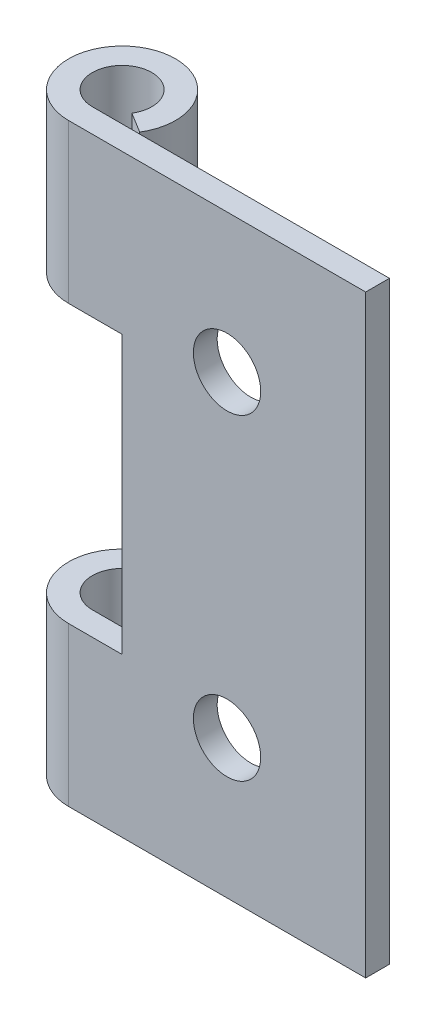
from build123d import *

# Parameters (mm, degrees)
Y_KSEKLIK_EKSTR_ZYON1_DEPTH = 30
KES_EKSTR_ZYON2_START       = -22
KES_EKSTR_ZYON2_DEPTH       = 14
IZIM4_R                     = 1.7
KES_EKSTR_ZYON3_DEPTH       = 1.2


with BuildPart() as part:
    # Çizim1 → Yükseklik-Ekstrüzyon1 (new body)
    with BuildSketch(Plane(origin=(0, 0, 0), x_dir=(1, 0, 0), z_dir=(0, 1, 0))):
        with BuildLine():
            Line((0, 0.6), (15, 0.6))
            Line((15, 0.6), (15, -0.6))
            Line((15, -0.6), (0, -0.6))
            ThreePointArc((0, -0.6), (-1.319038138, 4.455873169), (2.301841896, 0.688786378))
            Line((2.301841896, 0.688786378), (1.278801053, 1.315992432))
            ThreePointArc((1.278801053, 1.315992432), (-0.732798966, 3.408818427), (0, 0.6))
        make_face()
    extrude(amount=-Y_KSEKLIK_EKSTR_ZYON1_DEPTH)

    # Çizim3 → Kes-Ekstrüzyon2 (cut)
    with BuildSketch(Plane.XZ.offset(30).offset(KES_EKSTR_ZYON2_START)):
        with BuildLine():
            Line((1.278801053, -1.315992432), (2.301841896, -0.688786378))
            ThreePointArc((2.301841896, -0.688786378), (-1.319038138, -4.455873169), (0, 0.6))
            Line((0, 0.6), (2.7, 0.6))
            Line((2.7, 0.6), (2.7, -0.6))
            Line((2.7, -0.6), (0, -0.6))
            ThreePointArc((0, -0.6), (-0.732798966, -3.408818427), (1.278801053, -1.315992432))
        make_face()
    extrude(amount=KES_EKSTR_ZYON2_DEPTH, mode=Mode.SUBTRACT)

    # Çizim4 → Kes-Ekstrüzyon3 (cut)
    with BuildSketch(Plane(origin=(0, 0, -0.6), x_dir=(-1, 0, 0), z_dir=(0, 0, -1))):
        with Locations((-8, -23)):
            Circle(IZIM4_R)
        with Locations((-8, -7)):
            Circle(IZIM4_R)
    extrude(amount=-KES_EKSTR_ZYON3_DEPTH, mode=Mode.SUBTRACT)


solid = part.part
